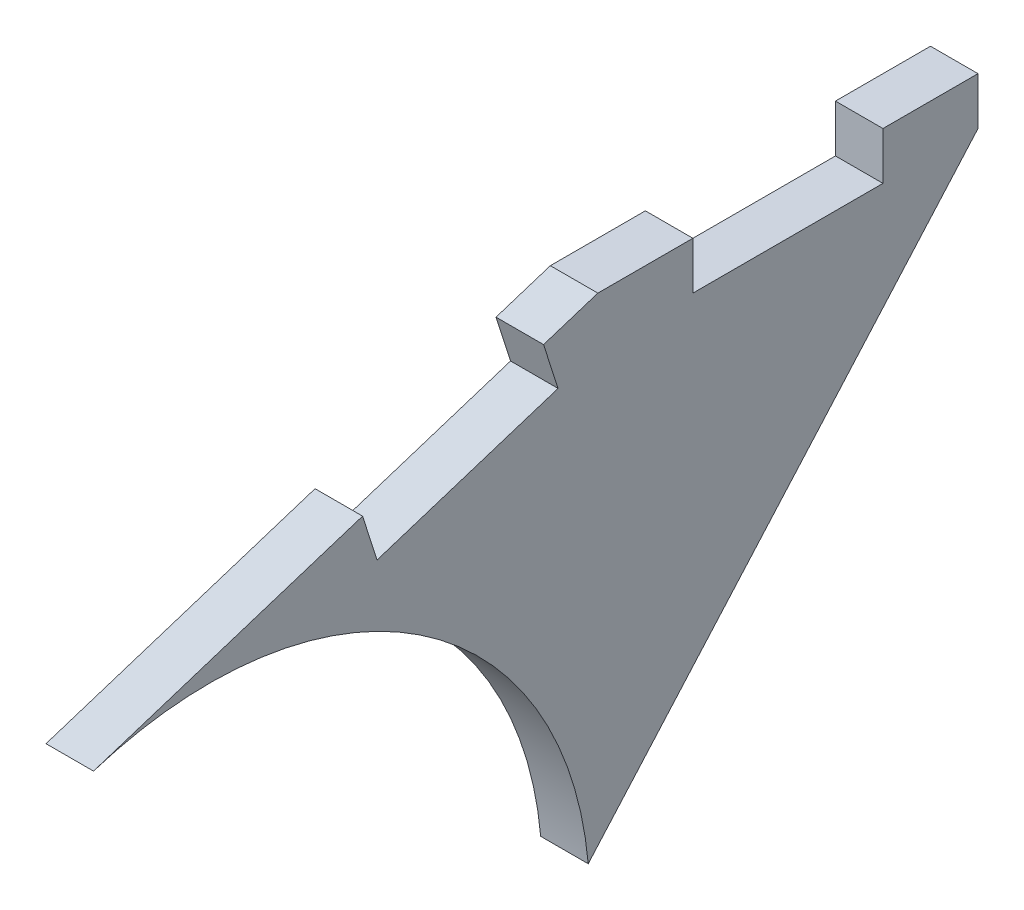
from build123d import *

# Parameters (mm, degrees)
BOSS_EXTRUDE1_DEPTH = 1.5875


with BuildPart() as part:
    # Sketch1 → Boss-Extrude1 (new body)
    with BuildSketch(Plane(origin=(0, 0, 0), x_dir=(0, 0, -1), z_dir=(1, 0, 0))):
        with BuildLine():
            Line((-6.398003714, -0.75184), (-6.398003714, -2.33934))
            Line((-6.398003714, -2.33934), (-19.419469424, -17.102153274))
            ThreePointArc((-19.419469424, -17.102153274), (-25.055238608, -7.661312267), (-35.94689414, -6.156914384))
            Line((-35.94689414, -6.156914384), (-26.958444364, -3.273446191))
            Line((-26.958444364, -3.273446191), (-26.473520097, -4.785069393))
            Line((-26.473520097, -4.785069393), (-20.427027289, -2.845372323))
            Line((-20.427027289, -2.845372323), (-20.911951556, -1.333749121))
            Line((-20.911951556, -1.333749121), (-19.098003714, -0.75184))
            Line((-19.098003714, -0.75184), (-15.923003714, -0.75184))
            Line((-15.923003714, -0.75184), (-15.923003714, -2.33934))
            Line((-15.923003714, -2.33934), (-9.573003714, -2.33934))
            Line((-9.573003714, -2.33934), (-9.573003714, -0.75184))
            Line((-9.573003714, -0.75184), (-6.398003714, -0.75184))
        make_face()
    extrude(amount=BOSS_EXTRUDE1_DEPTH)


solid = part.part
